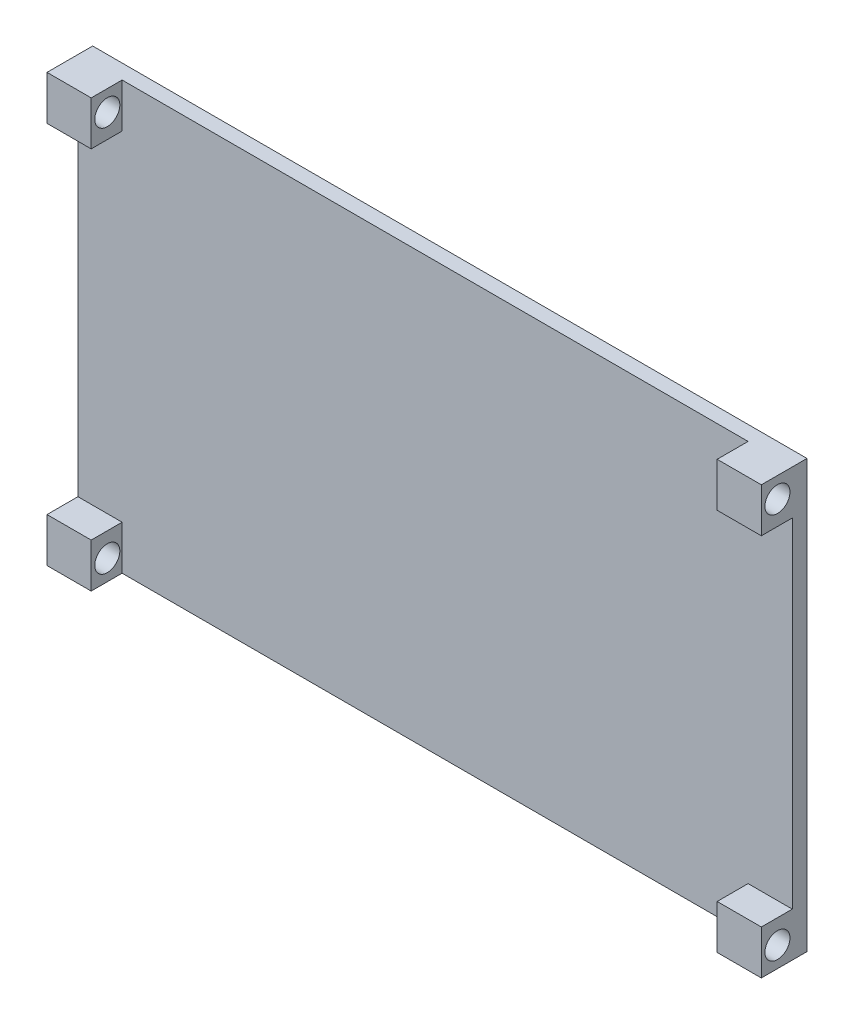
from build123d import *

# Parameters (mm, degrees)
CROQUIS1_W              = 97
CROQUIS1_H              = 58
SALIENTE_EXTRUIR1_DEPTH = 2
CROQUIS2_W              = 6
CROQUIS2_H              = 6
SALIENTE_EXTRUIR2_DEPTH = 4.2
CROQUIS3_R              = 1.7
CORTAR_EXTRUIR1_DEPTH   = 102.329363957


with BuildPart() as part:
    # Croquis1 → Saliente-Extruir1 (new body)
    with BuildSketch(Plane.XY):
        Rectangle(CROQUIS1_W, CROQUIS1_H)
    extrude(amount=-SALIENTE_EXTRUIR1_DEPTH)

    # Croquis2 → Saliente-Extruir2 (add)
    with BuildSketch(Plane.XY):
        with Locations((-45.5, 26)):
            Rectangle(CROQUIS2_W, CROQUIS2_H)
        with Locations((-45.5, -26)):
            Rectangle(CROQUIS2_W, CROQUIS2_H)
        with Locations((45.5, -26)):
            Rectangle(CROQUIS2_W, CROQUIS2_H)
        with Locations((45.5, 26)):
            Rectangle(CROQUIS2_W, CROQUIS2_H)
    extrude(amount=SALIENTE_EXTRUIR2_DEPTH)

    # Croquis3 → Cortar-Extruir1 (cut, through all)
    with BuildSketch(Plane.ZY.offset(48.5)):
        with Locations(Location((2.011535927, 26.225, 0), (0, 0, 270))):
            Circle(CROQUIS3_R)
        with Locations(Location((2.011535927, -26.225, 0), (0, 0, 270))):
            Circle(CROQUIS3_R)
    extrude(amount=-CORTAR_EXTRUIR1_DEPTH, mode=Mode.SUBTRACT)


solid = part.part
